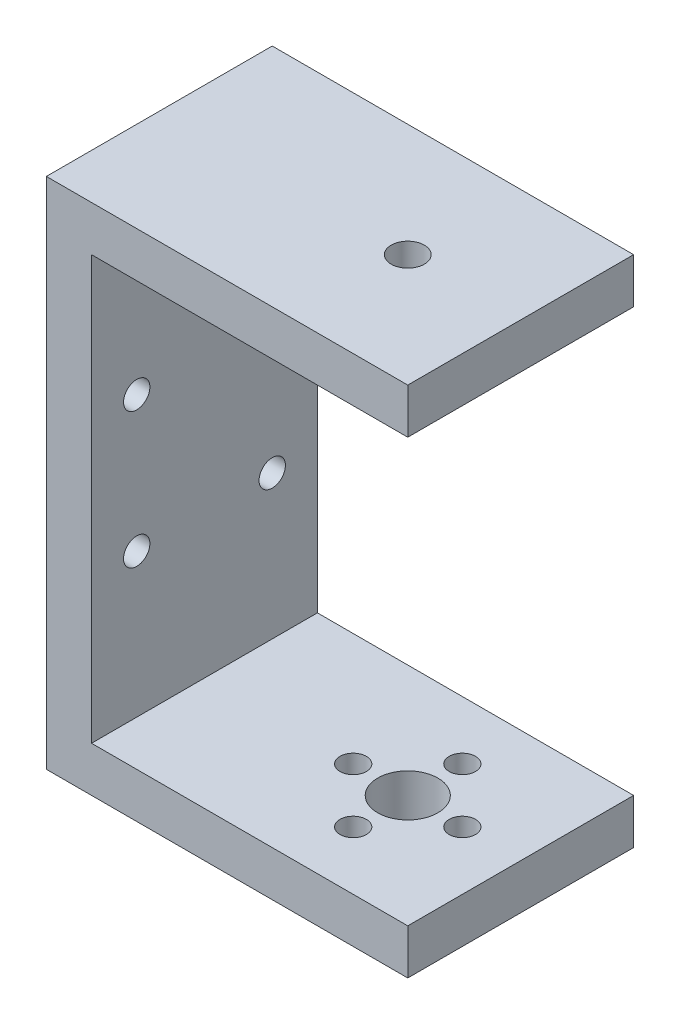
from build123d import *

# Parameters (mm, degrees)
SKETCH1_W           = 48
SKETCH1_H           = 68.2
BOSS_EXTRUDE1_DEPTH = 30
SKETCH2_W           = 42
SKETCH2_H           = 56.2
CUT_EXTRUDE1_DEPTH  = 52.369348838
SKETCH4_R           = 4
SKETCH4_R_2         = 1.75
CUT_EXTRUDE3_DEPTH  = 30
SKETCH5_R           = 2.2
CUT_EXTRUDE4_DEPTH  = 30
SKETCH6_R           = 1.75
CUT_EXTRUDE5_DEPTH  = 62.861215636


with BuildPart() as part:
    # Sketch1 → Boss-Extrude1 (new body)
    with BuildSketch(Plane.XY):
        Rectangle(SKETCH1_W, SKETCH1_H)
    extrude(amount=BOSS_EXTRUDE1_DEPTH)

    # Sketch2 → Cut-Extrude1 (cut, through all)
    with BuildSketch(Plane.XY.offset(30)):
        with Locations((3, 0)):
            Rectangle(SKETCH2_W, SKETCH2_H)
    extrude(amount=-CUT_EXTRUDE1_DEPTH, mode=Mode.SUBTRACT)

    # Sketch4 → Cut-Extrude3 (cut)
    with BuildSketch(Plane.XZ.offset(34.1)):
        with Locations(Location((9, 15, 0), (0, 0, 270))):
            Circle(SKETCH4_R)
        with Locations(Location((9, 22.25, 0), (0, 0, 270))):
            Circle(SKETCH4_R_2)
        with Locations(Location((16.25, 15, 0), (0, 0, 270))):
            Circle(SKETCH4_R_2)
        with Locations(Location((9, 7.75, 0), (0, 0, 270))):
            Circle(SKETCH4_R_2)
        with Locations(Location((1.75, 15, 0), (0, 0, 270))):
            Circle(SKETCH4_R_2)
    extrude(amount=-CUT_EXTRUDE3_DEPTH, mode=Mode.SUBTRACT)

    # Sketch5 → Cut-Extrude4 (cut)
    with BuildSketch(Plane(origin=(0, 34.1, 0), x_dir=(1, 0, 0), z_dir=(0, 1, 0))):
        with Locations(Location((9, -15, 0), (0, 0, 270))):
            Circle(SKETCH5_R)
    extrude(amount=-CUT_EXTRUDE4_DEPTH, mode=Mode.SUBTRACT)

    # Sketch6 → Cut-Extrude5 (cut, through all)
    with BuildSketch(Plane(origin=(-18, 0, 0), x_dir=(0, 0, -1), z_dir=(1, 0, 0))):
        with Locations((-24, -9)):
            Circle(SKETCH6_R)
        with Locations(Location((-6, -9, 0), (0, 0, 180))):
            Circle(SKETCH6_R)
        with Locations((-6, 9)):
            Circle(SKETCH6_R)
        with Locations(Location((-24, 9, 0), (0, 0, 180))):
            Circle(SKETCH6_R)
    extrude(amount=-CUT_EXTRUDE5_DEPTH, mode=Mode.SUBTRACT)


solid = part.part
